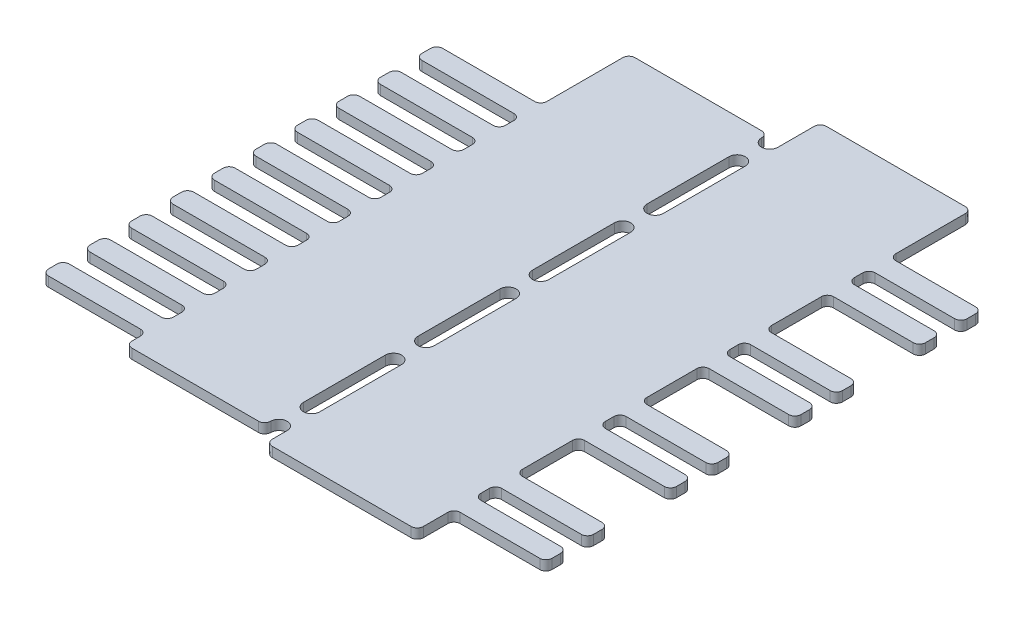
from build123d import *

# Parameters (mm, degrees)
BOSS_EXTRUDE1_DEPTH   = 1.2
CUT_EXTRUDE1_DEPTH    = 85.432032428
BODY_MOVE_COPY1_ANGLE = 180


with BuildPart() as part:
    # Sketch1 → Boss-Extrude1 (new body)
    with BuildSketch(Plane(origin=(0, 0, 0), x_dir=(1, 0, 0), z_dir=(0, 1, 0))):
        with BuildLine():
            Line((-0.75, 10), (-10.5, 10))
            ThreePointArc((-10.5, 10), (-11.030330086, 10.219669914), (-11.25, 10.75))
            Line((-11.25, 10.75), (-11.25, 11.79))
            ThreePointArc((-11.25, 11.79), (-11.030330086, 12.320330086), (-10.5, 12.54))
            Line((-10.5, 12.54), (-0.75, 12.54))
            ThreePointArc((-0.75, 12.54), (-0.219669914, 12.759669914), (0, 13.29))
            Line((0, 13.29), (0, 14.33))
            ThreePointArc((0, 14.33), (-0.219669914, 14.860330086), (-0.75, 15.08))
            Line((-0.75, 15.08), (-10.5, 15.08))
            ThreePointArc((-10.5, 15.08), (-11.030330086, 15.299669914), (-11.25, 15.83))
            Line((-11.25, 15.83), (-11.25, 16.87))
            ThreePointArc((-11.25, 16.87), (-11.030330086, 17.400330086), (-10.5, 17.62))
            Line((-10.5, 17.62), (-0.75, 17.62))
            ThreePointArc((-0.75, 17.62), (-0.219669914, 17.839669914), (0, 18.37))
            Line((0, 18.37), (0, 24.49))
            ThreePointArc((0, 24.49), (-0.219669914, 25.020330086), (-0.75, 25.24))
            Line((-0.75, 25.24), (-10.5, 25.24))
            ThreePointArc((-10.5, 25.24), (-11.030330086, 25.459669914), (-11.25, 25.99))
            Line((-11.25, 25.99), (-11.25, 27.03))
            ThreePointArc((-11.25, 27.03), (-11.030330086, 27.560330086), (-10.5, 27.78))
            Line((-10.5, 27.78), (-0.75, 27.78))
            ThreePointArc((-0.75, 27.78), (-0.219669914, 27.999669914), (0, 28.53))
            Line((0, 28.53), (0, 29.57))
            ThreePointArc((0, 29.57), (-0.219669914, 30.100330086), (-0.75, 30.32))
            Line((-0.75, 30.32), (-10.5, 30.32))
            ThreePointArc((-10.5, 30.32), (-11.030330086, 30.539669914), (-11.25, 31.07))
            Line((-11.25, 31.07), (-11.25, 32.11))
            ThreePointArc((-11.25, 32.11), (-11.030330086, 32.640330086), (-10.5, 32.86))
            Line((-10.5, 32.86), (-0.75, 32.86))
            ThreePointArc((-0.75, 32.86), (-0.219669914, 33.079669914), (0, 33.61))
            Line((0, 33.61), (0, 39.73))
            ThreePointArc((0, 39.73), (-0.219669914, 40.260330086), (-0.75, 40.48))
            Line((-0.75, 40.48), (-10.5, 40.48))
            ThreePointArc((-10.5, 40.48), (-11.030330086, 40.699669914), (-11.25, 41.23))
            Line((-11.25, 41.23), (-11.25, 42.27))
            ThreePointArc((-11.25, 42.27), (-11.030330086, 42.800330086), (-10.5, 43.02))
            Line((-10.5, 43.02), (-0.75, 43.02))
            ThreePointArc((-0.75, 43.02), (-0.219669914, 43.239669914), (0, 43.77))
            Line((0, 43.77), (0, 44.81))
            ThreePointArc((0, 44.81), (-0.219669914, 45.340330086), (-0.75, 45.56))
            Line((-0.75, 45.56), (-10.5, 45.56))
            ThreePointArc((-10.5, 45.56), (-11.030330086, 45.779669914), (-11.25, 46.31))
            Line((-11.25, 46.31), (-11.25, 47.35))
            ThreePointArc((-11.25, 47.35), (-11.030330086, 47.880330086), (-10.5, 48.1))
            Line((-10.5, 48.1), (-0.75, 48.1))
            ThreePointArc((-0.75, 48.1), (-0.219669914, 48.319669914), (0, 48.85))
            Line((0, 48.85), (0, 54.97))
            ThreePointArc((0, 54.97), (-0.219669914, 55.500330086), (-0.75, 55.72))
            Line((-0.75, 55.72), (-10.5, 55.72))
            ThreePointArc((-10.5, 55.72), (-11.030330086, 55.939669914), (-11.25, 56.47))
            Line((-11.25, 56.47), (-11.25, 57.51))
            ThreePointArc((-11.25, 57.51), (-11.030330086, 58.040330086), (-10.5, 58.26))
            Line((-10.5, 58.26), (-0.75, 58.26))
            ThreePointArc((-0.75, 58.26), (-0.219669914, 58.479669914), (0, 59.01))
            Line((0, 59.01), (0, 60.05))
            ThreePointArc((0, 60.05), (-0.219669914, 60.580330086), (-0.75, 60.8))
            Line((-0.75, 60.8), (-10.5, 60.8))
            ThreePointArc((-10.5, 60.8), (-11.030330086, 61.019669914), (-11.25, 61.55))
            Line((-11.25, 61.55), (-11.25, 62.59))
            ThreePointArc((-11.25, 62.59), (-11.030330086, 63.120330086), (-10.5, 63.34))
            Line((-10.5, 63.34), (-0.75, 63.34))
            ThreePointArc((-0.75, 63.34), (-0.219669914, 63.559669914), (0, 64.09))
            Line((0, 64.09), (0, 67.09))
            ThreePointArc((0, 67.09), (0.219669914, 67.620330086), (0.75, 67.84))
            Line((0.75, 67.84), (17.75, 67.84))
            ThreePointArc((17.75, 67.84), (18.280330086, 67.620330086), (18.5, 67.09))
            Line((18.5, 67.09), (18.5, 65.27050991))
            ThreePointArc((18.5, 65.27050991), (19.5, 64.27050991), (20.5, 65.27050991))
            ThreePointArc((20.5, 65.27050991), (20.719669914, 65.800839996), (21.25, 66.02050991))
            Line((21.25, 66.02050991), (36.75, 66.02050991))
            ThreePointArc((36.75, 66.02050991), (37.280330086, 65.800839996), (37.5, 65.27050991))
            Line((37.5, 65.27050991), (37.5, 64.23050991))
            ThreePointArc((37.5, 64.23050991), (37.719669914, 63.700179824), (38.25, 63.48050991))
            Line((38.25, 63.48050991), (49.5, 63.48050991))
            ThreePointArc((49.5, 63.48050991), (50.030330086, 63.260839996), (50.25, 62.73050991))
            Line((50.25, 62.73050991), (50.25, 61.69050991))
            ThreePointArc((50.25, 61.69050991), (50.030330086, 61.160179824), (49.5, 60.94050991))
            Line((49.5, 60.94050991), (38.25, 60.94050991))
            ThreePointArc((38.25, 60.94050991), (37.719669914, 60.720839996), (37.5, 60.19050991))
            Line((37.5, 60.19050991), (37.5, 59.15050991))
            ThreePointArc((37.5, 59.15050991), (37.719669914, 58.620179824), (38.25, 58.40050991))
            Line((38.25, 58.40050991), (49.5, 58.40050991))
            ThreePointArc((49.5, 58.40050991), (50.030330086, 58.180839996), (50.25, 57.65050991))
            Line((50.25, 57.65050991), (50.25, 56.61050991))
            ThreePointArc((50.25, 56.61050991), (50.030330086, 56.080179824), (49.5, 55.86050991))
            Line((49.5, 55.86050991), (38.25, 55.86050991))
            ThreePointArc((38.25, 55.86050991), (37.719669914, 55.640839996), (37.5, 55.11050991))
            Line((37.5, 55.11050991), (37.5, 54.07050991))
            ThreePointArc((37.5, 54.07050991), (37.719669914, 53.540179824), (38.25, 53.32050991))
            Line((38.25, 53.32050991), (49.5, 53.32050991))
            ThreePointArc((49.5, 53.32050991), (50.030330086, 53.100839996), (50.25, 52.57050991))
            Line((50.25, 52.57050991), (50.25, 51.53050991))
            ThreePointArc((50.25, 51.53050991), (50.030330086, 51.000179824), (49.5, 50.78050991))
            Line((49.5, 50.78050991), (38.25, 50.78050991))
            ThreePointArc((38.25, 50.78050991), (37.719669914, 50.560839996), (37.5, 50.03050991))
            Line((37.5, 50.03050991), (37.5, 48.99050991))
            ThreePointArc((37.5, 48.99050991), (37.719669914, 48.460179824), (38.25, 48.24050991))
            Line((38.25, 48.24050991), (49.5, 48.24050991))
            ThreePointArc((49.5, 48.24050991), (50.030330086, 48.020839996), (50.25, 47.49050991))
            Line((50.25, 47.49050991), (50.25, 46.45050991))
            ThreePointArc((50.25, 46.45050991), (50.030330086, 45.920179824), (49.5, 45.70050991))
            Line((49.5, 45.70050991), (38.25, 45.70050991))
            ThreePointArc((38.25, 45.70050991), (37.719669914, 45.480839996), (37.5, 44.95050991))
            Line((37.5, 44.95050991), (37.5, 43.91050991))
            ThreePointArc((37.5, 43.91050991), (37.719669914, 43.380179824), (38.25, 43.16050991))
            Line((38.25, 43.16050991), (49.5, 43.16050991))
            ThreePointArc((49.5, 43.16050991), (50.030330086, 42.940839996), (50.25, 42.41050991))
            Line((50.25, 42.41050991), (50.25, 41.37050991))
            ThreePointArc((50.25, 41.37050991), (50.030330086, 40.840179824), (49.5, 40.62050991))
            Line((49.5, 40.62050991), (38.25, 40.62050991))
            ThreePointArc((38.25, 40.62050991), (37.719669914, 40.400839996), (37.5, 39.87050991))
            Line((37.5, 39.87050991), (37.5, 38.83050991))
            ThreePointArc((37.5, 38.83050991), (37.719669914, 38.300179824), (38.25, 38.08050991))
            Line((38.25, 38.08050991), (49.5, 38.08050991))
            ThreePointArc((49.5, 38.08050991), (50.030330086, 37.860839996), (50.25, 37.33050991))
            Line((50.25, 37.33050991), (50.25, 36.29050991))
            ThreePointArc((50.25, 36.29050991), (50.030330086, 35.760179824), (49.5, 35.54050991))
            Line((49.5, 35.54050991), (38.25, 35.54050991))
            ThreePointArc((38.25, 35.54050991), (37.719669914, 35.320839996), (37.5, 34.79050991))
            Line((37.5, 34.79050991), (37.5, 33.75050991))
            ThreePointArc((37.5, 33.75050991), (37.719669914, 33.220179824), (38.25, 33.00050991))
            Line((38.25, 33.00050991), (49.5, 33.00050991))
            ThreePointArc((49.5, 33.00050991), (50.030330086, 32.780839996), (50.25, 32.25050991))
            Line((50.25, 32.25050991), (50.25, 31.21050991))
            ThreePointArc((50.25, 31.21050991), (50.030330086, 30.680179824), (49.5, 30.46050991))
            Line((49.5, 30.46050991), (38.25, 30.46050991))
            ThreePointArc((38.25, 30.46050991), (37.719669914, 30.240839996), (37.5, 29.71050991))
            Line((37.5, 29.71050991), (37.5, 28.67050991))
            ThreePointArc((37.5, 28.67050991), (37.719669914, 28.140179824), (38.25, 27.92050991))
            Line((38.25, 27.92050991), (49.5, 27.92050991))
            ThreePointArc((49.5, 27.92050991), (50.030330086, 27.700839996), (50.25, 27.17050991))
            Line((50.25, 27.17050991), (50.25, 26.13050991))
            ThreePointArc((50.25, 26.13050991), (50.030330086, 25.600179824), (49.5, 25.38050991))
            Line((49.5, 25.38050991), (38.25, 25.38050991))
            ThreePointArc((38.25, 25.38050991), (37.719669914, 25.160839996), (37.5, 24.63050991))
            Line((37.5, 24.63050991), (37.5, 23.59050991))
            ThreePointArc((37.5, 23.59050991), (37.719669914, 23.060179824), (38.25, 22.84050991))
            Line((38.25, 22.84050991), (49.5, 22.84050991))
            ThreePointArc((49.5, 22.84050991), (50.030330086, 22.620839996), (50.25, 22.09050991))
            Line((50.25, 22.09050991), (50.25, 21.05050991))
            ThreePointArc((50.25, 21.05050991), (50.030330086, 20.520179824), (49.5, 20.30050991))
            Line((49.5, 20.30050991), (38.25, 20.30050991))
            ThreePointArc((38.25, 20.30050991), (37.719669914, 20.080839996), (37.5, 19.55050991))
            Line((37.5, 19.55050991), (37.5, 18.51050991))
            ThreePointArc((37.5, 18.51050991), (37.719669914, 17.980179824), (38.25, 17.76050991))
            Line((38.25, 17.76050991), (49.5, 17.76050991))
            ThreePointArc((49.5, 17.76050991), (50.030330086, 17.540839996), (50.25, 17.01050991))
            Line((50.25, 17.01050991), (50.25, 15.97050991))
            ThreePointArc((50.25, 15.97050991), (50.030330086, 15.440179824), (49.5, 15.22050991))
            Line((49.5, 15.22050991), (38.25, 15.22050991))
            ThreePointArc((38.25, 15.22050991), (37.719669914, 15.000839996), (37.5, 14.47050991))
            Line((37.5, 14.47050991), (37.5, 5.18300671))
            ThreePointArc((37.5, 5.18300671), (37.280330086, 4.652676624), (36.75, 4.43300671))
            Line((36.75, 4.43300671), (21.25, 4.43300671))
            ThreePointArc((21.25, 4.43300671), (20.719669914, 4.652676624), (20.5, 5.18300671))
            ThreePointArc((20.5, 5.18300671), (19.5, 6.18300671), (18.5, 5.18300671))
            Line((18.5, 5.18300671), (18.5, 0.75))
            ThreePointArc((18.5, 0.75), (18.280330086, 0.219669914), (17.75, 0))
            Line((17.75, 0), (0.75, 0))
            ThreePointArc((0.75, 0), (0.219669914, 0.219669914), (0, 0.75))
            Line((0, 0.75), (0, 9.25))
            ThreePointArc((0, 9.25), (-0.219669914, 9.780330086), (-0.75, 10))
        make_face()
    extrude(amount=BOSS_EXTRUDE1_DEPTH)

    # Sketch2 → Cut-Extrude1 (cut, through all)
    with BuildSketch(Plane.XZ):
        with BuildLine():
            Line((18.5, -61.27050991), (18.5, -51.25050991))
            ThreePointArc((18.5, -51.25050991), (19.5, -50.25050991), (20.5, -51.25050991))
            Line((20.5, -51.25050991), (20.5, -61.27050991))
            ThreePointArc((20.5, -61.27050991), (19.5, -62.27050991), (18.5, -61.27050991))
        make_face()
        with BuildLine():
            Line((18.5, -47.25050991), (18.5, -37.23050991))
            ThreePointArc((18.5, -37.23050991), (19.5, -36.23050991), (20.5, -37.23050991))
            Line((20.5, -37.23050991), (20.5, -47.25050991))
            ThreePointArc((20.5, -47.25050991), (19.5, -48.25050991), (18.5, -47.25050991))
        make_face()
        with BuildLine():
            Line((18.5, -23.20300671), (18.5, -33.22300671))
            ThreePointArc((18.5, -33.22300671), (19.5, -34.22300671), (20.5, -33.22300671))
            Line((20.5, -33.22300671), (20.5, -23.20300671))
            ThreePointArc((20.5, -23.20300671), (19.5, -22.20300671), (18.5, -23.20300671))
        make_face()
        with BuildLine():
            Line((18.5, -9.18300671), (18.5, -19.20300671))
            ThreePointArc((18.5, -19.20300671), (19.5, -20.20300671), (20.5, -19.20300671))
            Line((20.5, -19.20300671), (20.5, -9.18300671))
            ThreePointArc((20.5, -9.18300671), (19.5, -8.18300671), (18.5, -9.18300671))
        make_face()
    extrude(amount=-CUT_EXTRUDE1_DEPTH, mode=Mode.SUBTRACT)


with BuildPart() as part_1:
    # Body-Move/Copy1: moved
    add(part.part.rotate(Axis((17.625, 0, -34.92), (0, 1, 0)), BODY_MOVE_COPY1_ANGLE))


solid = part_1.part
